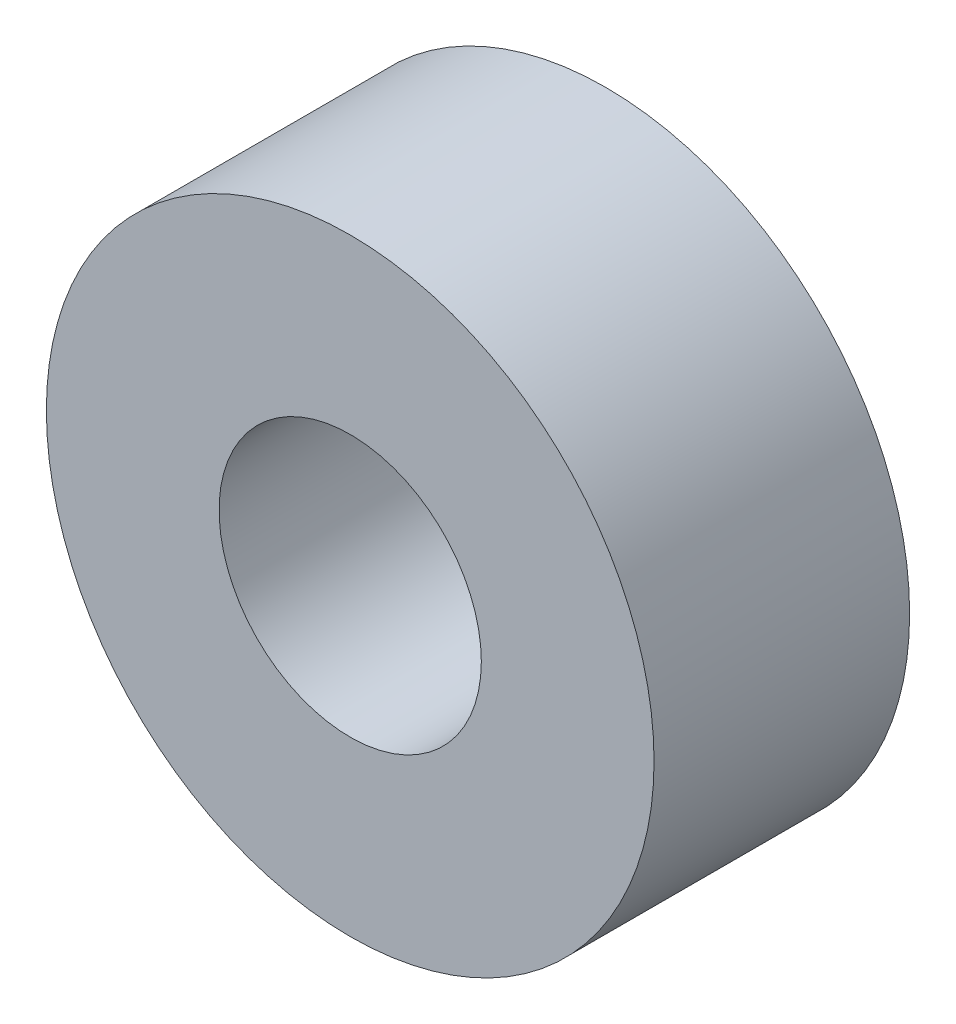
from build123d import *

# Parameters (mm, degrees)
SKETCH1_R           = 41.61
BOSS_EXTRUDE1_DEPTH = 35
SKETCH2_R           = 17.9565
CUT_EXTRUDE1_DEPTH  = 35


with BuildPart() as part:
    # Sketch1 → Boss-Extrude1 (new body)
    with BuildSketch(Plane.XY):
        Circle(SKETCH1_R)
    extrude(amount=BOSS_EXTRUDE1_DEPTH)

    # Sketch2 → Cut-Extrude1 (cut)
    with BuildSketch(Plane.XY.offset(35)):
        Circle(SKETCH2_R)
    extrude(amount=-CUT_EXTRUDE1_DEPTH, mode=Mode.SUBTRACT)


solid = part.part
